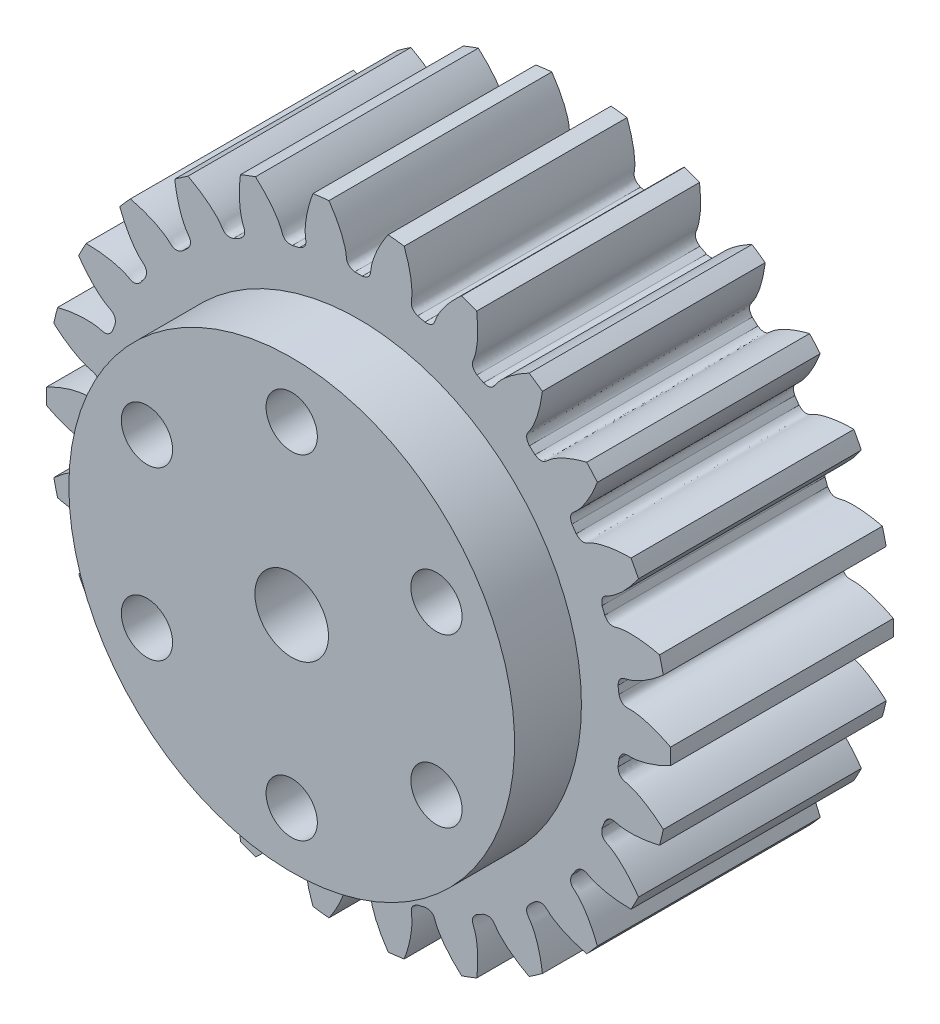
from build123d import *

# Parameters (mm, degrees)
SKETCH_1_R               = 14
EXTRUDE_1_DEPTH          = 30
CUT_EXTRUDE_1_DEPTH      = 36.944401511
PATTERN_CIRCULAR_1_COUNT = 26
SKETCH_4_R               = 22.986088603
CUT_EXTRUDE_2_DEPTH      = 20
SKETCH_5_R               = 1.65
CUT_EXTRUDE1_DEPTH       = 23.141270561
SKETCH1_R                = 1.15
CUT_EXTRUDE2_DEPTH       = 23.141270561
BOSS_EXTRUDE2_START      = -3
SKETCH3_R                = 10
SKETCH3_R_2              = 1.15
SKETCH3_R_3              = 1.65
BOSS_EXTRUDE2_DEPTH      = 3
SKETCH4_R                = 2.25
CUT_EXTRUDE4_DEPTH       = 10


with BuildPart() as part:
    # 草图1 → 凸台-拉伸1 (new body)
    with BuildSketch(Plane.XY):
        Circle(SKETCH_1_R)
    extrude(amount=EXTRUDE_1_DEPTH)

    # 草图2 → 切除-拉伸1 (cut, through all)
    with BuildSketch(Plane.XY):
        with BuildLine():
            ThreePointArc((0.167083101, 11.748811993), (0, 11.75), (-0.167083101, 11.748811993))
            add(Edge.make_bspline(
                [(-0.167083101, 11.748811993), (-0.563124577, 11.823786529), (-0.530341496, 12.057947243), (-0.567403325, 12.292184585), (-0.572970232, 12.323456208), (-0.580116691, 12.359402536), (-0.589023906, 12.399972719), (-0.599881743, 12.445108232), (-0.612875107, 12.494745567), (-0.628188152, 12.548815414), (-0.646002754, 12.607242983), (-0.666498787, 12.669947973), (-0.689853847, 12.736844645), (-0.716243145, 12.807841884), (-0.745839354, 12.882843252), (-0.778812465, 12.961747062), (-0.81532965, 13.044446443), (-0.855555122, 13.130829413), (-0.899649995, 13.220778958), (-0.947772153, 13.314173109), (-1.000076112, 13.410885026), (-1.056712894, 13.510783085), (-1.117829892, 13.613730968), (-1.183570747, 13.719587755), (-1.254075224, 13.828208021), (-1.329479086, 13.939441936), (-1.409913975, 14.053135367), (-1.495507297, 14.169129981), (-1.586382107, 14.287263358), (-1.682656994, 14.4073691), (-1.784445973, 14.529276944), (-1.891858381, 14.652812882), (-2.004998768, 14.777799277), (-2.1239668, 14.90405499), (-2.248857162, 15.0313955), (-2.379759459, 15.159633035), (-2.516758128, 15.2885767), (-2.659932355, 15.418032609), (-2.809355947, 15.547804024), (-3.019513125, 15.723073841), (-3.182995671, 15.851209993), (-3.294909156, 15.935451864)],
                knots=[0, 0, 0, 0, 0.122665365, 0.127715434, 0.133683697, 0.140570154, 0.148374806, 0.157097651, 0.166738691, 0.177297926, 0.188775354, 0.201170977, 0.214484794, 0.228716806, 0.243867011, 0.259935411, 0.276922005, 0.294826794, 0.313649777, 0.333390954, 0.354050325, 0.37562789, 0.39812365, 0.421537604, 0.445869753, 0.471120096, 0.497288632, 0.524375364, 0.552380289, 0.581303409, 0.611144723, 0.641904231, 0.673581934, 0.706177831, 0.739691922, 0.774124208, 0.809474687, 0.845743361, 0.88293023, 0.921035292, 1, 1, 1, 1], degree=3))
            ThreePointArc((-3.294909156, 15.935451864), (0, 16.272524465), (3.294909156, 15.935451864))
            add(Edge.make_bspline(
                [(0.167083101, 11.748811993), (0.563124577, 11.823786529), (0.530341496, 12.057947243), (0.567403325, 12.292184585), (0.572970232, 12.323456208), (0.580116691, 12.359402536), (0.589023906, 12.399972719), (0.599881743, 12.445108232), (0.612875107, 12.494745567), (0.628188152, 12.548815414), (0.646002754, 12.607242983), (0.666498787, 12.669947973), (0.689853847, 12.736844645), (0.716243145, 12.807841884), (0.745839354, 12.882843252), (0.778812465, 12.961747062), (0.81532965, 13.044446443), (0.855555122, 13.130829413), (0.899649995, 13.220778958), (0.947772153, 13.314173109), (1.000076112, 13.410885026), (1.056712894, 13.510783085), (1.117829892, 13.613730968), (1.183570747, 13.719587755), (1.254075224, 13.828208021), (1.329479086, 13.939441936), (1.409913975, 14.053135367), (1.495507297, 14.169129981), (1.586382107, 14.287263358), (1.682656994, 14.4073691), (1.784445973, 14.529276944), (1.891858381, 14.652812882), (2.004998768, 14.777799277), (2.1239668, 14.90405499), (2.248857162, 15.0313955), (2.379759459, 15.159633035), (2.516758128, 15.2885767), (2.659932355, 15.418032609), (2.809355947, 15.547804024), (3.019513125, 15.723073841), (3.182995671, 15.851209993), (3.294909156, 15.935451864)],
                knots=[0, 0, 0, 0, 0.122665365, 0.127715434, 0.133683697, 0.140570154, 0.148374806, 0.157097651, 0.166738691, 0.177297926, 0.188775354, 0.201170977, 0.214484794, 0.228716806, 0.243867011, 0.259935411, 0.276922005, 0.294826794, 0.313649777, 0.333390954, 0.354050325, 0.37562789, 0.39812365, 0.421537604, 0.445869753, 0.471120096, 0.497288632, 0.524375364, 0.552380289, 0.581303409, 0.611144723, 0.641904231, 0.673581934, 0.706177831, 0.739691922, 0.774124208, 0.809474687, 0.845743361, 0.88293023, 0.921035292, 1, 1, 1, 1], degree=3))
        make_face()
    cut_extrude_1 = extrude(amount=CUT_EXTRUDE_1_DEPTH, mode=Mode.SUBTRACT)

    # 阵列(圆周)1: 切除-拉伸1 ×26 about axis
    pattern_circular_1_axis = Axis((0, 0, 30), (0, 0, -1))
    for i in range(1, PATTERN_CIRCULAR_1_COUNT):
        add(cut_extrude_1.rotate(pattern_circular_1_axis, i * 360 / PATTERN_CIRCULAR_1_COUNT), mode=Mode.SUBTRACT)

    # 草图4 → 切除-拉伸2 (cut)
    with BuildSketch(Plane.XY.offset(30)):
        Circle(SKETCH_4_R)
    extrude(amount=-CUT_EXTRUDE_2_DEPTH, mode=Mode.SUBTRACT)

    # 草图5 → Cut-Extrude1 (cut, through all)
    with BuildSketch(Plane.XY.offset(10)):
        Circle(SKETCH_5_R)
    extrude(amount=-CUT_EXTRUDE1_DEPTH, mode=Mode.SUBTRACT)

    # Sketch1 → Cut-Extrude2 (cut, through all)
    with BuildSketch(Plane.XY.offset(10)):
        with Locations((6.495190528, 3.75)):
            Circle(SKETCH1_R)
        with Locations((6.495190528, -3.75)):
            Circle(SKETCH1_R)
        with Locations((0, -7.5)):
            Circle(SKETCH1_R)
        with Locations((-6.495190528, -3.75)):
            Circle(SKETCH1_R)
        with Locations((-6.495190528, 3.75)):
            Circle(SKETCH1_R)
        with Locations((0, 7.5)):
            Circle(SKETCH1_R)
    extrude(amount=-CUT_EXTRUDE2_DEPTH, mode=Mode.SUBTRACT)

    # Sketch3 → Boss-Extrude2 (add)
    with BuildSketch(Plane(origin=(0, 0, 10), x_dir=(-1, 0, 0), z_dir=(0, 0, -1)).offset(BOSS_EXTRUDE2_START)):
        Circle(SKETCH3_R)
        with Locations(Location((6.495190528, -3.75, 0), (0, 0, 180))):
            Circle(SKETCH3_R_2, mode=Mode.SUBTRACT)
        with Locations(Location((6.495190528, 3.75, 0), (0, 0, 180))):
            Circle(SKETCH3_R_2, mode=Mode.SUBTRACT)
        with Locations(Location((0, -7.5, 0), (0, 0, 180))):
            Circle(SKETCH3_R_2, mode=Mode.SUBTRACT)
        with Locations(Location((0, 0, 0), (0, 0, 180))):
            Circle(SKETCH3_R_3, mode=Mode.SUBTRACT)
        with Locations(Location((-6.495190528, -3.75, 0), (0, 0, 180))):
            Circle(SKETCH3_R_2, mode=Mode.SUBTRACT)
        with Locations(Location((-6.495190528, 3.75, 0), (0, 0, 180))):
            Circle(SKETCH3_R_2, mode=Mode.SUBTRACT)
        with Locations(Location((0, 7.5, 0), (0, 0, 180))):
            Circle(SKETCH3_R_2, mode=Mode.SUBTRACT)
    extrude(amount=BOSS_EXTRUDE2_DEPTH)

    # Sketch4 → Cut-Extrude4 (cut)
    with BuildSketch(Plane(origin=(0, 0, 0), x_dir=(-1, 0, 0), z_dir=(0, 0, -1))):
        with Locations((0, 7.5)):
            Circle(SKETCH4_R)
        with Locations((6.495190528, 3.75)):
            Circle(SKETCH4_R)
        with Locations((6.495190528, -3.75)):
            Circle(SKETCH4_R)
        with Locations((0, -7.5)):
            Circle(SKETCH4_R)
        with Locations((-6.495190528, -3.75)):
            Circle(SKETCH4_R)
        with Locations((-6.495190528, 3.75)):
            Circle(SKETCH4_R)
    extrude(amount=-CUT_EXTRUDE4_DEPTH, mode=Mode.SUBTRACT)


solid = part.part
